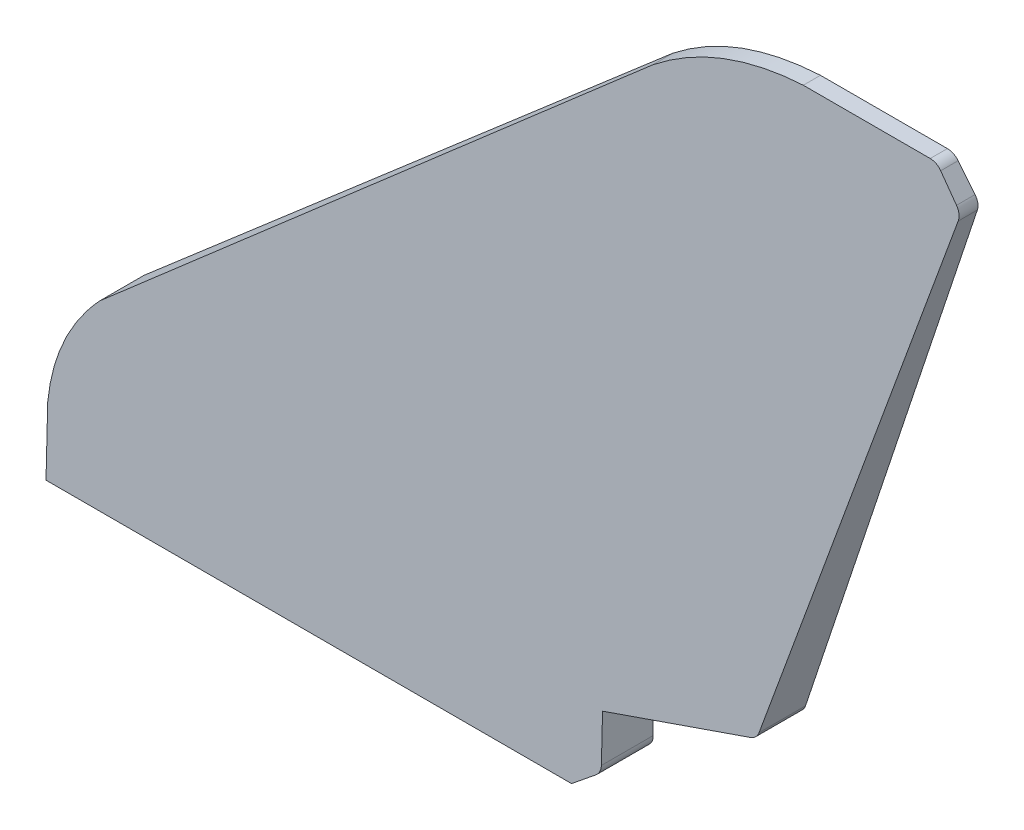
from build123d import *

# Parameters (mm, degrees)
BOSS_EXTRUDE1_DEPTH     = 304.8
CUT_EXTRUDE2_DEPTH      = 13037.539327922
CUT_EXTRUDE2_DEPTH_BACK = 13037.539327922
FILLET1_R               = 152.4
FILLET2_R               = 152.4
FILLET3_R               = 152.4
FILLET4_R               = 152.4


with BuildPart() as part:
    # Sketch5 → Boss-Extrude1 (new, symmetric)
    with BuildSketch(Plane.XY.offset(-537.673251463)):
        with BuildLine():
            Line((742.082193598, 0), (742.082193598, 764.574485823))
            add(Edge.make_bspline(
                [(742.082193598, 764.574485823), (796.791514491, 1480.759447712), (1302.621022267, 2026.444470026)],
                knots=[0, 0, 0, 1, 1, 1], degree=2))
            Line((1302.621022267, 2026.444470026), (7478.539858356, 7379.645861756))
            add(Edge.make_bspline(
                [(9179.137959243, 8019.288), (8219.319485977, 7966.614763447), (7478.539858356, 7379.645861756)],
                knots=[0, 0, 0, 1, 1, 1], degree=2))
            Line((9179.137959243, 8019.288), (10703.137959243, 8019.288))
            Line((10703.137959243, 8019.288), (10985.744450733, 7649.32510556))
            Line((10985.744450733, 7649.32510556), (8816.798294342, 1464.02172706))
            Line((8816.798294342, 1464.02172706), (7072.277988354, 870.702642997))
            Line((7072.277988354, 870.702642997), (7072.277988354, 267.743129387))
            Line((7072.277988354, 267.743129387), (6740.737959243, 0))
            Line((6740.737959243, 0), (742.082193598, 0))
        make_face()
    extrude(amount=BOSS_EXTRUDE1_DEPTH, both=True)

    # Sketch7 → Cut-Extrude2 (cut, two sides: drawn at the far end of the back side and taken through both)
    with BuildSketch(Plane.ZY.offset(-742.082193598).offset(-CUT_EXTRUDE2_DEPTH_BACK)):
        Polygon((-842.473251463, 0), (-635.730191879, 8019.288), (-1159.108406809, 8019.288), (-1159.108406809, 0), align=None)
        Polygon((-439.616311048, 8019.288), (-232.873251463, 0), (0, 0), (55.656264928, 8019.288), align=None)
    extrude(amount=CUT_EXTRUDE2_DEPTH + CUT_EXTRUDE2_DEPTH_BACK, mode=Mode.SUBTRACT)

    # Fillet1
    fillet1_edges = [part.edges().sort_by_distance(p)[0] for p in [
        (10703.137959243, 8019.288, -537.673251463),
    ]]
    fillet(fillet1_edges, radius=FILLET1_R)

    # Fillet2
    fillet2_edges = [part.edges().sort_by_distance(p)[0] for p in [
        (10985.744450733, 7649.32510556, -537.673251463),
    ]]
    fillet(fillet2_edges, radius=FILLET2_R)

    # Fillet3
    fillet3_edges = [part.edges().sort_by_distance(p)[0] for p in [
        (8816.798294342, 1464.02172706, -537.673251463),
    ]]
    fillet(fillet3_edges, radius=FILLET3_R)

    # Fillet4
    fillet4_edges = [part.edges().sort_by_distance(p)[0] for p in [
        (7072.277988354, 267.743129387, -537.673251463),
    ]]
    fillet(fillet4_edges, radius=FILLET4_R)


solid = part.part
